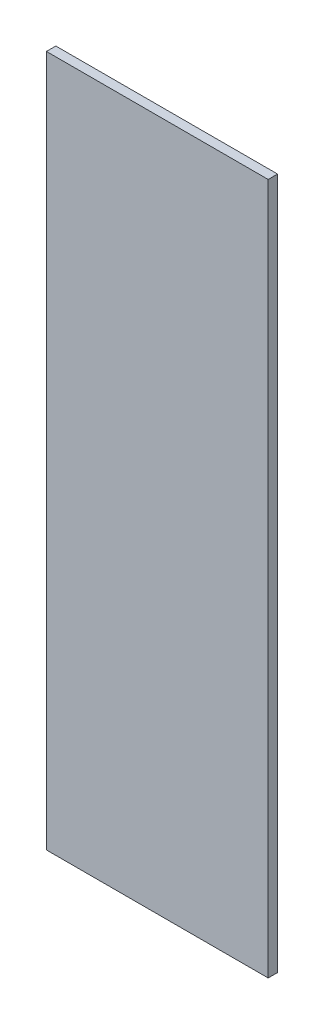
from build123d import *

# Parameters (mm, degrees)
SKETCH_2_W      = 118
SKETCH_2_H      = 368
EXTRUDE_1_DEPTH = 5


with BuildPart() as part:
    # 草图2 → 凸台-拉伸1 (new body)
    with BuildSketch(Plane.XY):
        Rectangle(SKETCH_2_W, SKETCH_2_H)
    extrude(amount=EXTRUDE_1_DEPTH)


solid = part.part
